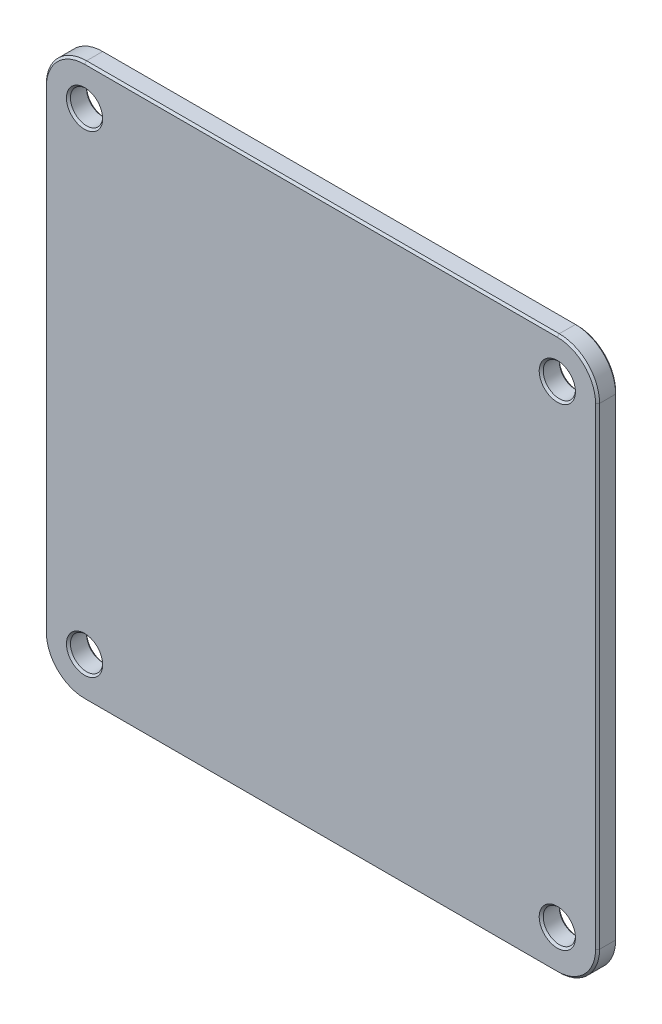
from build123d import *

# Parameters (mm, degrees)
SKETCH3_W           = 55
SKETCH3_H           = 55
BOSS_EXTRUDE1_DEPTH = 2
CUT_EXTRUDE1_DEPTH  = 2
SKETCH6_R           = 1.6
CUT_EXTRUDE2_DEPTH  = 39.942264957
CHAMFER1_SIZE       = 0.2
CHAMFER2_SIZE       = 0.2


with BuildPart() as part:
    # Sketch3 → Boss-Extrude1 (new body)
    with BuildSketch(Plane.XY):
        Rectangle(SKETCH3_W, SKETCH3_H)
    extrude(amount=BOSS_EXTRUDE1_DEPTH)

    # Sketch4 → Cut-Extrude1 (cut)
    with BuildSketch(Plane.XY.offset(2)):
        with BuildLine():
            Line((-23.5, 27.5), (-27.5, 27.5))
            Line((-27.5, 27.5), (-27.5, 23.5))
            ThreePointArc((-27.5, 23.5), (-26.328427125, 26.328427125), (-23.5, 27.5))
        make_face()
        with BuildLine():
            Line((23.5, 27.5), (27.5, 27.5))
            Line((27.5, 27.5), (27.5, 23.5))
            ThreePointArc((27.5, 23.5), (26.328427125, 26.328427125), (23.5, 27.5))
        make_face()
        with BuildLine():
            Line((27.5, -23.5), (27.5, -27.5))
            Line((27.5, -27.5), (23.5, -27.5))
            ThreePointArc((23.5, -27.5), (26.328427125, -26.328427125), (27.5, -23.5))
        make_face()
        with BuildLine():
            Line((-23.5, -27.5), (-27.5, -27.5))
            Line((-27.5, -27.5), (-27.5, -23.5))
            ThreePointArc((-27.5, -23.5), (-26.328427125, -26.328427125), (-23.5, -27.5))
        make_face()
    extrude(amount=-CUT_EXTRUDE1_DEPTH, mode=Mode.SUBTRACT)

    # Sketch6 → Cut-Extrude2 (cut, through all)
    with BuildSketch(Plane.XY.offset(2)):
        with Locations((23.5, 23.5)):
            Circle(SKETCH6_R)
        with Locations(Location((-23.5, 23.5, 0), (0, 0, 180))):
            Circle(SKETCH6_R)
        with Locations(Location((23.5, -23.5, 0), (0, 0, 180))):
            Circle(SKETCH6_R)
        with Locations((-23.5, -23.5)):
            Circle(SKETCH6_R)
    extrude(amount=-CUT_EXTRUDE2_DEPTH, mode=Mode.SUBTRACT)

    # Chamfer1
    chamfer1_edges = [part.edges().sort_by_distance(p)[0] for p in [
        (0, 27.5, 0),
        (26.328427125, 26.328427125, 0),
        (27.5, 0, 0),
        (0, -27.5, 0),
        (-27.5, 0, 0),
        (-26.328427125, 26.328427125, 0),
        (26.328427125, -26.328427125, 0),
        (-26.328427125, -26.328427125, 0),
        (21.9, 23.5, 0),
        (-21.9, 23.5, 0),
        (25.1, -23.5, 0),
        (-25.1, -23.5, 0),
    ]]
    chamfer(chamfer1_edges, length=CHAMFER1_SIZE)

    # Chamfer2
    chamfer2_edges = [part.edges().sort_by_distance(p)[0] for p in [
        (0, 27.5, 2),
        (26.328427125, 26.328427125, 2),
        (-27.5, 0, 2),
        (0, -27.5, 2),
        (27.5, 0, 2),
        (-26.328427125, 26.328427125, 2),
        (26.328427125, -26.328427125, 2),
        (-26.328427125, -26.328427125, 2),
        (21.9, 23.5, 2),
        (-21.9, 23.5, 2),
        (25.1, -23.5, 2),
        (-25.1, -23.5, 2),
    ]]
    chamfer(chamfer2_edges, length=CHAMFER2_SIZE)


solid = part.part
